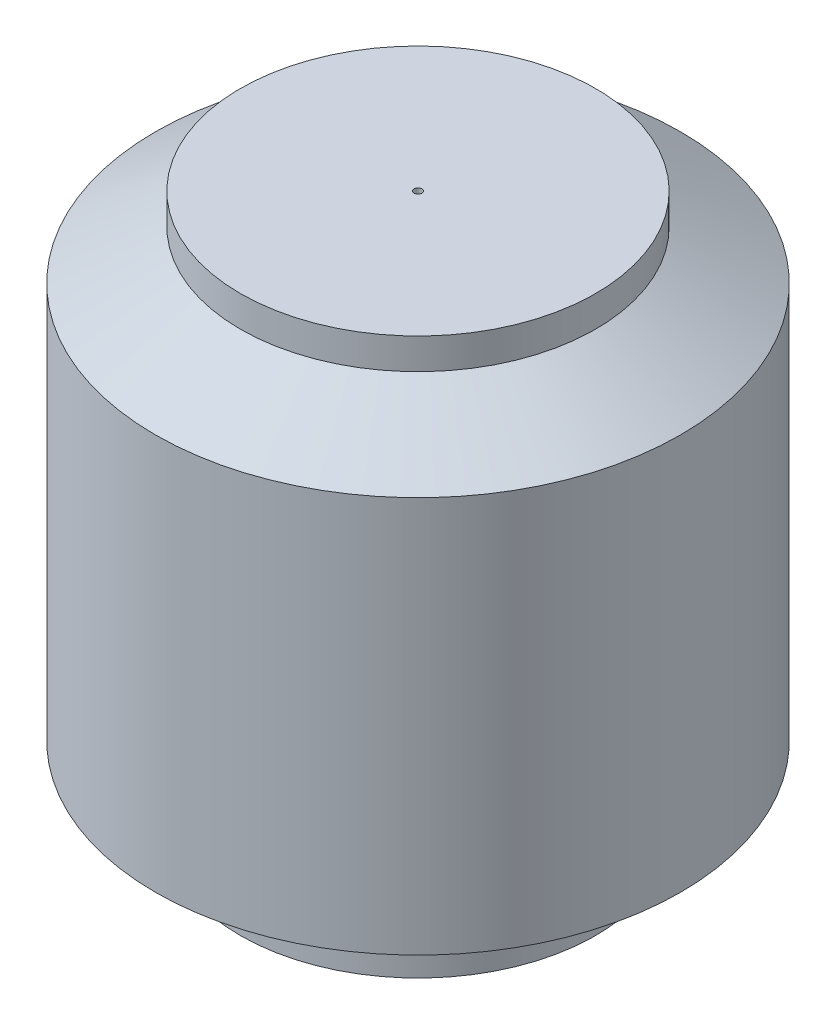
from build123d import *

# Parameters (mm, degrees)
SKETCH2_R          = 1.25
CUT_EXTRUDE1_DEPTH = 217.448608219
CHAMFER1_SIZE      = 2


with BuildPart() as part:
    # Sketch1 → Revolve1 (revolve)
    with BuildSketch(Plane.XY, mode=Mode.PRIVATE) as revolve1_sk:
        Polygon((0, 0), (-57.5, 0), (-57.5, -10), (-85, -25.877132403), (-85, -154.122867597), (-57.5, -170), (-57.5, -180), (0, -180), align=None)
    revolve(revolve1_sk.sketch.rotate(Axis((0, 52.509012346, 0), (0, -1, 0)), 270), axis=Axis((0, 52.509012346, 0), (0, -1, 0)))

    # Sketch2 → Cut-Extrude1 (cut, through all)
    with BuildSketch(Plane(origin=(0, 0, 0), x_dir=(1, 0, 0), z_dir=(0, 1, 0))):
        with Locations(Location((0, 0, 0), (0, 0, 270))):
            Circle(SKETCH2_R)
    extrude(amount=-CUT_EXTRUDE1_DEPTH, mode=Mode.SUBTRACT)

    # Chamfer1
    chamfer1_edges = [part.edges().sort_by_distance(p)[0] for p in [
        (0, -180, -1.25),
    ]]
    chamfer(chamfer1_edges, length=CHAMFER1_SIZE)


solid = part.part
